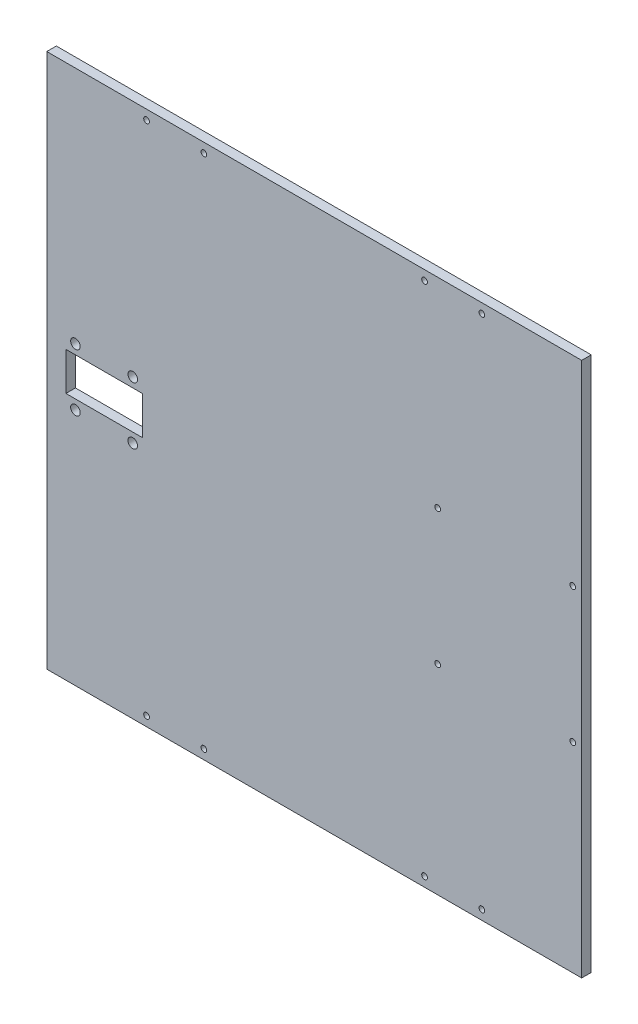
from build123d import *

# Parameters (mm, degrees)
SKETCH_1_W      = 280
SKETCH_1_H      = 280
SKETCH_1_R      = 1.5
SKETCH_1_R_2    = 2.5
SKETCH_1_W_2    = 40
SKETCH_1_H_2    = 20
EXTRUDE_1_DEPTH = 5


with BuildPart() as part:
    # 草图1 → 凸台-拉伸1 (new body)
    with BuildSketch(Plane.XY):
        Rectangle(SKETCH_1_W, SKETCH_1_H)
        with Locations((-87.76, 135)):
            Circle(SKETCH_1_R, mode=Mode.SUBTRACT)
        with Locations((-57.76, 135)):
            Circle(SKETCH_1_R, mode=Mode.SUBTRACT)
        with Locations(Location((57.76, 135, 0), (0, 0, 180))):
            Circle(SKETCH_1_R, mode=Mode.SUBTRACT)
        with Locations(Location((87.76, 135, 0), (0, 0, 180))):
            Circle(SKETCH_1_R, mode=Mode.SUBTRACT)
        with Locations((87.76, -135)):
            Circle(SKETCH_1_R, mode=Mode.SUBTRACT)
        with Locations((57.76, -135)):
            Circle(SKETCH_1_R, mode=Mode.SUBTRACT)
        with Locations(Location((-57.76, -135, 0), (0, 0, 180))):
            Circle(SKETCH_1_R, mode=Mode.SUBTRACT)
        with Locations(Location((-87.76, -135, 0), (0, 0, 180))):
            Circle(SKETCH_1_R, mode=Mode.SUBTRACT)
        with Locations((64.644660941, 35.355339059)):
            Circle(SKETCH_1_R, mode=Mode.SUBTRACT)
        with Locations((135.355339059, 35.355339059)):
            Circle(SKETCH_1_R, mode=Mode.SUBTRACT)
        with Locations((64.644660941, -35.355339059)):
            Circle(SKETCH_1_R, mode=Mode.SUBTRACT)
        with Locations((135.355339059, -35.355339059)):
            Circle(SKETCH_1_R, mode=Mode.SUBTRACT)
        with Locations((-95, 15)):
            Circle(SKETCH_1_R_2, mode=Mode.SUBTRACT)
        with Locations((-125, 15)):
            Circle(SKETCH_1_R_2, mode=Mode.SUBTRACT)
        with Locations((-125, -15)):
            Circle(SKETCH_1_R_2, mode=Mode.SUBTRACT)
        with Locations((-95, -15)):
            Circle(SKETCH_1_R_2, mode=Mode.SUBTRACT)
        with Locations((-110, 0)):
            Rectangle(SKETCH_1_W_2, SKETCH_1_H_2, mode=Mode.SUBTRACT)
    extrude(amount=EXTRUDE_1_DEPTH)


solid = part.part
